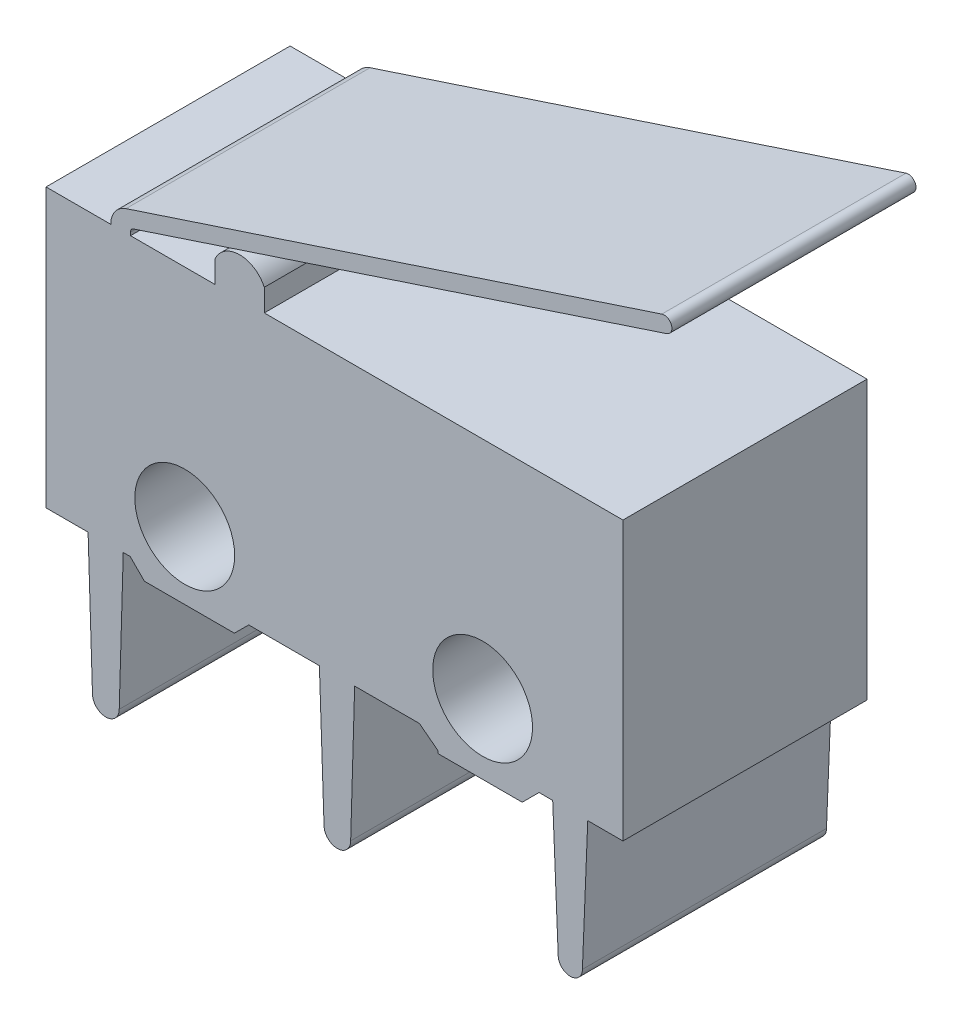
from build123d import *

# Parameters (mm, degrees)
IZIM1_R                     = 1.125
Y_KSEKLIK_EKSTR_ZYON1_DEPTH = 5.5


with BuildPart() as part:
    # Çizim1 → Yükseklik-Ekstrüzyon1 (new body)
    with BuildSketch(Plane.XY):
        with BuildLine():
            Line((-0.73750862, -36.078547579), (0.210244923, -36.078547579))
            Line((0.210244923, -36.078547579), (0.309026113, -39.184890491))
            ThreePointArc((0.309026113, -39.184890491), (0.610430221, -39.4862946), (0.91183433, -39.184890491))
            Line((0.91183433, -39.184890491), (1.002609544, -36.078547579))
            Line((1.002609544, -36.078547579), (1.157998466, -36.078547579))
            Line((1.157998466, -36.078547579), (1.480686358, -36.401235471))
            Line((1.480686358, -36.401235471), (3.507166322, -36.401235471))
            Line((3.507166322, -36.401235471), (3.829854214, -36.078547579))
            Line((3.829854214, -36.078547579), (5.422522789, -36.078547579))
            Line((5.422522789, -36.078547579), (5.526914996, -39.143906466))
            ThreePointArc((5.526914996, -39.143906466), (5.826979248, -39.443970718), (6.1270435, -39.143906466))
            Line((6.1270435, -39.143906466), (6.216621056, -36.078547579))
            Line((6.216621056, -36.078547579), (7.67629389, -36.078547579))
            Line((7.67629389, -36.078547579), (8.097584701, -36.401235471))
            Line((8.097584701, -36.401235471), (8.097584701, -36.457430984))
            Line((8.097584701, -36.457430984), (9.992871432, -36.457430984))
            Line((9.992871432, -36.457430984), (10.371754838, -36.078547579))
            Line((10.371754838, -36.078547579), (10.679552543, -36.078547579))
            Line((10.679552543, -36.078547579), (10.803656958, -39.041199534))
            ThreePointArc((10.803656958, -39.041199534), (11.076182099, -39.313724675), (11.34870724, -39.041199534))
            Line((11.34870724, -39.041199534), (11.469552543, -36.078547579))
            Line((11.469552543, -36.078547579), (12.26249138, -36.078547579))
            Line((12.26249138, -36.078547579), (12.26249138, -29.81509131))
            Line((12.26249138, -29.81509131), (4.18034079, -29.81509131))
            Line((4.18034079, -29.81509131), (4.18034079, -29.31509131))
            ThreePointArc((4.18034079, -29.31509131), (3.624816768, -28.956669378), (3.069292745, -29.31509131))
            Line((3.069292745, -29.31509131), (3.069292745, -29.81509131))
            Line((3.069292745, -29.81509131), (1.165892063, -29.81509131))
            Line((1.165892063, -29.81509131), (1.165892063, -29.744693477))
            ThreePointArc((1.165892063, -29.744693477), (1.184856501, -29.68609964), (1.234556818, -29.649729787))
            Line((1.234556818, -29.649729787), (13.247034334, -25.685962886))
            ThreePointArc((13.247034334, -25.685962886), (13.356857182, -25.468018658), (13.138932408, -25.358157209))
            Line((13.138932408, -25.358157209), (1.064608949, -29.337589121))
            ThreePointArc((1.064608949, -29.337589121), (0.815991055, -29.519422097), (0.721116967, -29.812463042))
            Line((0.721116967, -29.812463042), (0.721116967, -29.81509131))
            Line((0.721116967, -29.81509131), (-0.73750862, -29.81509131))
            Line((-0.73750862, -29.81509131), (-0.73750862, -36.078547579))
        make_face()
        with Locations((2.387599646, -34.883277444)):
            Circle(IZIM1_R, mode=Mode.SUBTRACT)
        with Locations((9.100214646, -34.883277444)):
            Circle(IZIM1_R, mode=Mode.SUBTRACT)
    extrude(amount=Y_KSEKLIK_EKSTR_ZYON1_DEPTH)


solid = part.part
